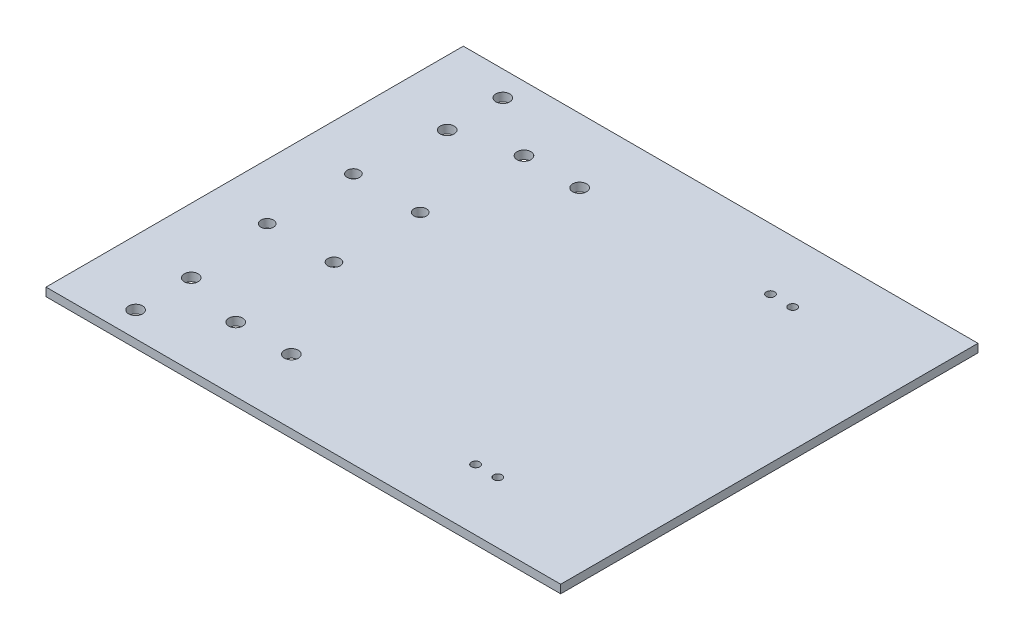
from build123d import *

# Parameters (mm, degrees)
SKETCH2_W           = 185
SKETCH2_H           = 150
BOSS_EXTRUDE1_DEPTH = 3
SKETCH3_R           = 1.5
SKETCH3_R_2         = 2.25
SKETCH3_R_3         = 2.5
CUT_EXTRUDE1_DEPTH  = 10


with BuildPart() as part:
    # Sketch2 → Boss-Extrude1 (new body)
    with BuildSketch(Plane(origin=(0, 0, 0), x_dir=(1, 0, 0), z_dir=(0, 1, 0))):
        with Locations((92.5, 75)):
            Rectangle(SKETCH2_W, SKETCH2_H)
    extrude(amount=BOSS_EXTRUDE1_DEPTH)

    # Sketch3 → Cut-Extrude1 (cut)
    with BuildSketch(Plane(origin=(0, 3, 0), x_dir=(1, 0, 0), z_dir=(0, 1, 0))):
        with Locations(Location((140.4, 128, 0), (0, 0, 270))):
            Circle(SKETCH3_R)
        with Locations(Location((132.4, 128, 0), (0, 0, 270))):
            Circle(SKETCH3_R)
        with Locations(Location((132.4, 22, 0), (0, 0, 90))):
            Circle(SKETCH3_R)
        with Locations(Location((140.4, 22, 0), (0, 0, 90))):
            Circle(SKETCH3_R)
        with Locations(Location((20, 90.5, 0), (0, 0, 270))):
            Circle(SKETCH3_R_2)
        with Locations(Location((44, 90.5, 0), (0, 0, 270))):
            Circle(SKETCH3_R_2)
        with Locations(Location((44, 59.5, 0), (0, 0, 90))):
            Circle(SKETCH3_R_2)
        with Locations(Location((20, 59.5, 0), (0, 0, 90))):
            Circle(SKETCH3_R_2)
        with Locations(Location((45, 23.2, 0), (0, 0, 270))):
            Circle(SKETCH3_R_3)
        with Locations(Location((65, 23.2, 0), (0, 0, 270))):
            Circle(SKETCH3_R_3)
        with Locations(Location((65, 126.8, 0), (0, 0, 90))):
            Circle(SKETCH3_R_3)
        with Locations(Location((45, 126.8, 0), (0, 0, 90))):
            Circle(SKETCH3_R_3)
        with Locations(Location((23.2, 9, 0), (0, 0, 270))):
            Circle(SKETCH3_R_3)
        with Locations(Location((23.2, 29, 0), (0, 0, 270))):
            Circle(SKETCH3_R_3)
        with Locations(Location((23.2, 121, 0), (0, 0, 90))):
            Circle(SKETCH3_R_3)
        with Locations(Location((23.2, 141, 0), (0, 0, 90))):
            Circle(SKETCH3_R_3)
    extrude(amount=-CUT_EXTRUDE1_DEPTH, mode=Mode.SUBTRACT)


solid = part.part
